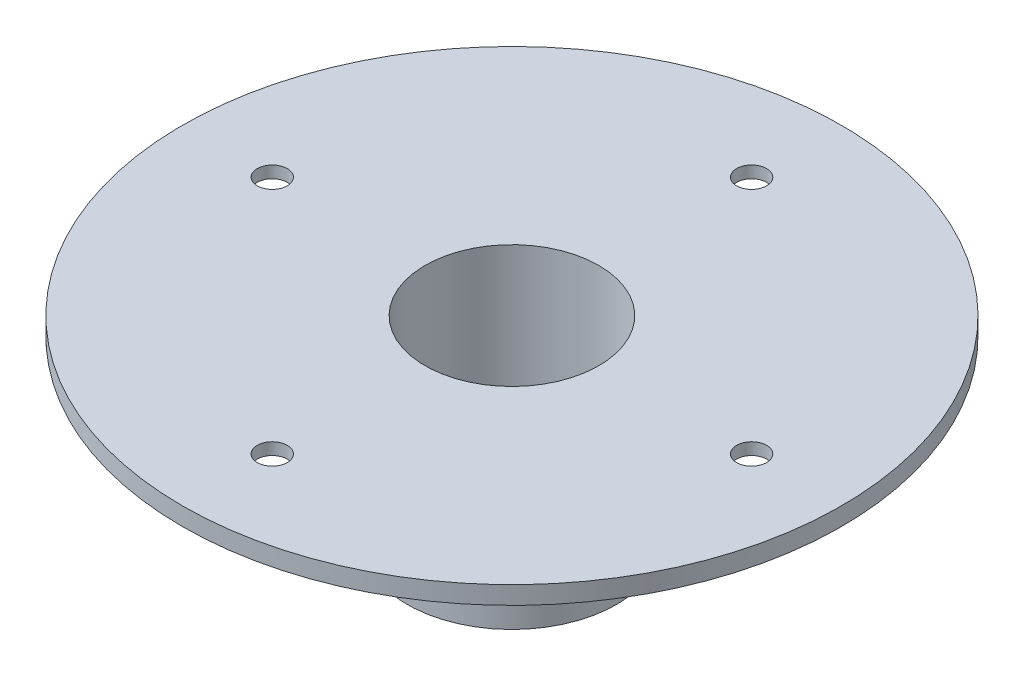
from build123d import *

# Parameters (mm, degrees)
SKETCH1_R           = 55
BOSS_EXTRUDE1_DEPTH = 3
SKETCH2_R           = 17.5
BOSS_EXTRUDE2_DEPTH = 30
SKETCH3_R           = 14.5
CUT_EXTRUDE1_DEPTH  = 85.492603227
SKETCH4_R           = 2.5
CUT_EXTRUDE2_DEPTH  = 85.492603227
SKETCH5_R           = 9
CUT_EXTRUDE3_DEPTH  = 1


with BuildPart() as part:
    # Sketch1 → Boss-Extrude1 (new body)
    with BuildSketch(Plane(origin=(0, 0, 0), x_dir=(1, 0, 0), z_dir=(0, 1, 0))):
        with Locations(Location((0, 0, 0), (0, 0, 270))):
            Circle(SKETCH1_R)
    extrude(amount=BOSS_EXTRUDE1_DEPTH)

    # Sketch2 → Boss-Extrude2 (add)
    with BuildSketch(Plane.XZ):
        with Locations(Location((0, 0, 0), (0, 0, 270))):
            Circle(SKETCH2_R)
    extrude(amount=BOSS_EXTRUDE2_DEPTH)

    # Sketch3 → Cut-Extrude1 (cut, through all)
    with BuildSketch(Plane.XZ.offset(30)):
        with Locations(Location((0, 0, 0), (0, 0, 270))):
            Circle(SKETCH3_R)
    extrude(amount=-CUT_EXTRUDE1_DEPTH, mode=Mode.SUBTRACT)

    # Sketch4 → Cut-Extrude2 (cut, through all)
    with BuildSketch(Plane(origin=(0, 3, 0), x_dir=(1, 0, 0), z_dir=(0, 1, 0))):
        with Locations(Location((0, 40, 0), (0, 0, 270))):
            Circle(SKETCH4_R)
        with Locations(Location((40, 0, 0), (0, 0, 270))):
            Circle(SKETCH4_R)
        with Locations(Location((0, -40, 0), (0, 0, 270))):
            Circle(SKETCH4_R)
        with Locations(Location((-40, 0, 0), (0, 0, 270))):
            Circle(SKETCH4_R)
    extrude(amount=-CUT_EXTRUDE2_DEPTH, mode=Mode.SUBTRACT)

    # Sketch5 → Cut-Extrude3 (cut)
    with BuildSketch(Plane.XZ):
        with Locations(Location((0, 40, 0), (0, 0, 270))):
            Circle(SKETCH5_R)
        with Locations(Location((40, 0, 0), (0, 0, 270))):
            Circle(SKETCH5_R)
        with Locations(Location((0, -40, 0), (0, 0, 270))):
            Circle(SKETCH5_R)
        with Locations(Location((-40, 0, 0), (0, 0, 270))):
            Circle(SKETCH5_R)
    extrude(amount=-CUT_EXTRUDE3_DEPTH, mode=Mode.SUBTRACT)


solid = part.part
